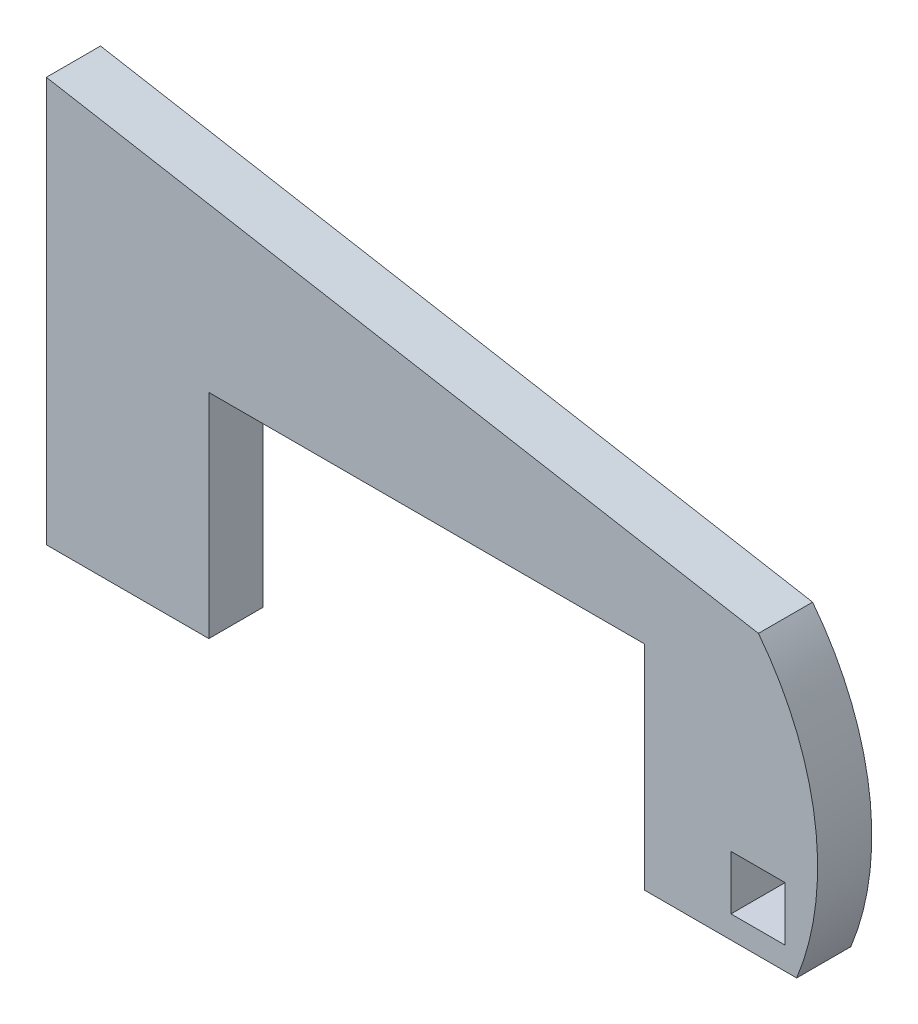
from build123d import *

# Parameters (mm, degrees)
BOSS_EXTRU_1_DEPTH      = 5
ESQUISSE2_W             = 5
ESQUISSE2_H             = 5
ENL_V_MAT_EXTRU_1_DEPTH = 5


with BuildPart() as part:
    # Esquisse1 → Boss.-Extru.1 (new body)
    with BuildSketch(Plane.XY):
        Polygon((0, 0), (0, -19.685), (20, -19.685), (20, 4.433365096), (-55.2, 17.693154046), (-55.2, -19.685), (-40.2, -19.685), (-40.2, 0), align=None)
    extrude(amount=BOSS_EXTRU_1_DEPTH)

    # Esquisse2 → Enlèv. mat.-Extru.1 (cut)
    with BuildSketch(Plane(origin=(0, 0, 0), x_dir=(-1, 0, 0), z_dir=(0, 0, -1))):
        with BuildLine():
            Line((-10.537175757, 6.101916324), (-11.23314954, 10.048979788))
            Line((-11.23314954, 10.048979788), (-30.732234233, 6.610765057))
            Line((-30.732234233, 6.610765057), (-25.732815565, -21.742347141))
            Line((-25.732815565, -21.742347141), (-14.065020128, -19.685))
            ThreePointArc((-14.065020128, -19.685), (-15.760051103, -6.318330994), (-10.537175757, 6.101916324))
        make_face()
        with Locations((-10.5, -15.0925)):
            Rectangle(ESQUISSE2_W, ESQUISSE2_H)
    extrude(amount=-ENL_V_MAT_EXTRU_1_DEPTH, mode=Mode.SUBTRACT)


solid = part.part
